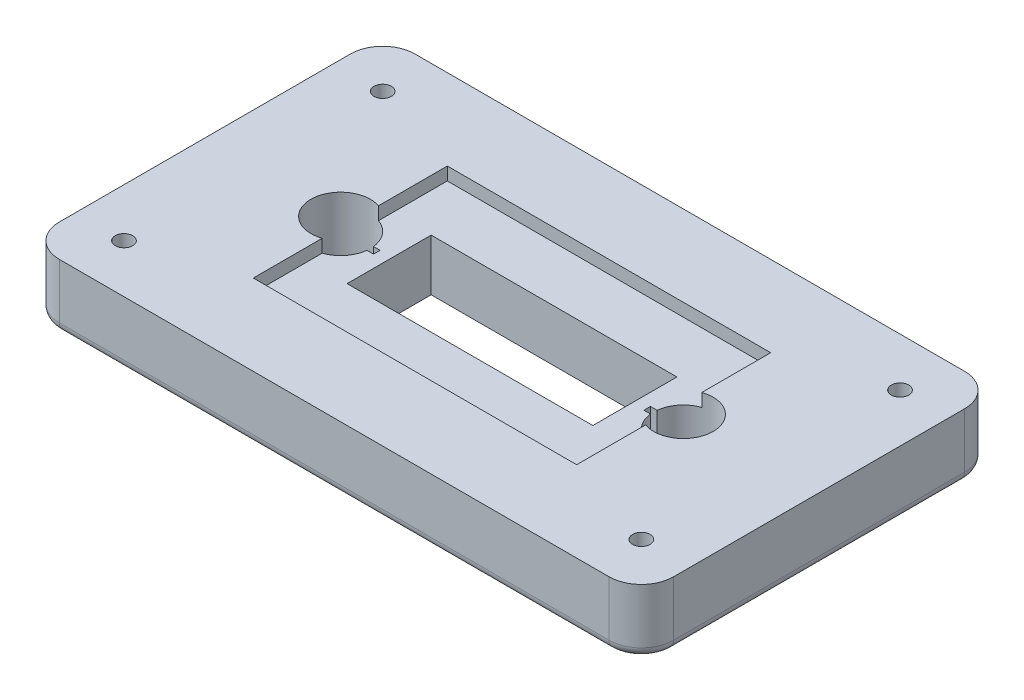
from build123d import *

# Parameters (mm, degrees)
BOSS_EXTRUDE1_DEPTH = 10
SKETCH2_R           = 1.35
CUT_EXTRUDE2_DEPTH  = 56.789784011
FILLET4_R           = 1.5
SKETCH4_W           = 38
SKETCH4_H           = 13
CUT_EXTRUDE3_DEPTH  = 56.789784011
SKETCH5_W           = 50
SKETCH5_H           = 30
CUT_EXTRUDE5_DEPTH  = 2


with BuildPart() as part:
    # Sketch1 → Boss-Extrude1 (new body)
    with BuildSketch(Plane(origin=(0, 0, 0), x_dir=(1, 0, 0), z_dir=(0, 1, 0))):
        with BuildLine():
            Line((-42.5, -27.5), (42.5, -27.5))
            ThreePointArc((42.5, -27.5), (46.035533906, -26.035533906), (47.5, -22.5))
            Line((47.5, -22.5), (47.5, 22.5))
            ThreePointArc((47.5, 22.5), (46.035533906, 26.035533906), (42.5, 27.5))
            Line((42.5, 27.5), (-42.5, 27.5))
            ThreePointArc((-42.5, 27.5), (-46.035533906, 26.035533906), (-47.5, 22.5))
            Line((-47.5, 22.5), (-47.5, -22.5))
            ThreePointArc((-47.5, -22.5), (-46.035533906, -26.035533906), (-42.5, -27.5))
        make_face()
    extrude(amount=BOSS_EXTRUDE1_DEPTH)

    # Sketch2 → Cut-Extrude2 (cut, through all)
    with BuildSketch(Plane(origin=(0, 10, 0), x_dir=(1, 0, 0), z_dir=(0, 1, 0))):
        with Locations((-40, 20)):
            Circle(SKETCH2_R)
        with Locations((-40, -20)):
            Circle(SKETCH2_R)
        with Locations((40, -20)):
            Circle(SKETCH2_R)
        with Locations((40, 20)):
            Circle(SKETCH2_R)
    extrude(amount=-CUT_EXTRUDE2_DEPTH, mode=Mode.SUBTRACT)

    # Fillet4
    fillet4_edges = [part.edges().sort_by_distance(p)[0] for p in [
        (47.5, 0, 0),
        (0, 0, -27.5),
        (0, 0, 27.5),
        (-47.5, 0, 0),
        (-46.035533906, 0, -26.035533906),
        (46.035533906, 0, -26.035533906),
        (46.035533906, 0, 26.035533906),
        (-46.035533906, 0, 26.035533906),
    ]]
    fillet(fillet4_edges, radius=FILLET4_R)

    # Sketch4 → Cut-Extrude3 (cut, through all)
    with BuildSketch(Plane(origin=(0, 0, 0), x_dir=(-1, 0, 0), z_dir=(0, -1, 0))):
        Rectangle(SKETCH4_W, SKETCH4_H)
        with BuildLine():
            Line((20.903728907, -0.502566941), (20.903728907, 0.502566941))
            Line((20.903728907, 0.502566941), (21.927536061, 0.502566941))
            ThreePointArc((21.927536061, 0.502566941), (31.1, 0), (21.927536061, -0.502566941))
            Line((21.927536061, -0.502566941), (20.903728907, -0.502566941))
        make_face()
        with BuildLine():
            Line((-20.903728907, -0.502566941), (-21.927536061, -0.502566941))
            ThreePointArc((-21.927536061, -0.502566941), (-31.1, 0), (-21.927536061, 0.502566941))
            Line((-21.927536061, 0.502566941), (-20.903728907, 0.502566941))
            Line((-20.903728907, 0.502566941), (-20.903728907, -0.502566941))
        make_face()
    extrude(amount=-CUT_EXTRUDE3_DEPTH, mode=Mode.SUBTRACT)

    # Sketch5 → Cut-Extrude5 (cut)
    with BuildSketch(Plane(origin=(0, 10, 0), x_dir=(1, 0, 0), z_dir=(0, 1, 0))):
        Rectangle(SKETCH5_W, SKETCH5_H)
    extrude(amount=-CUT_EXTRUDE5_DEPTH, mode=Mode.SUBTRACT)


solid = part.part
